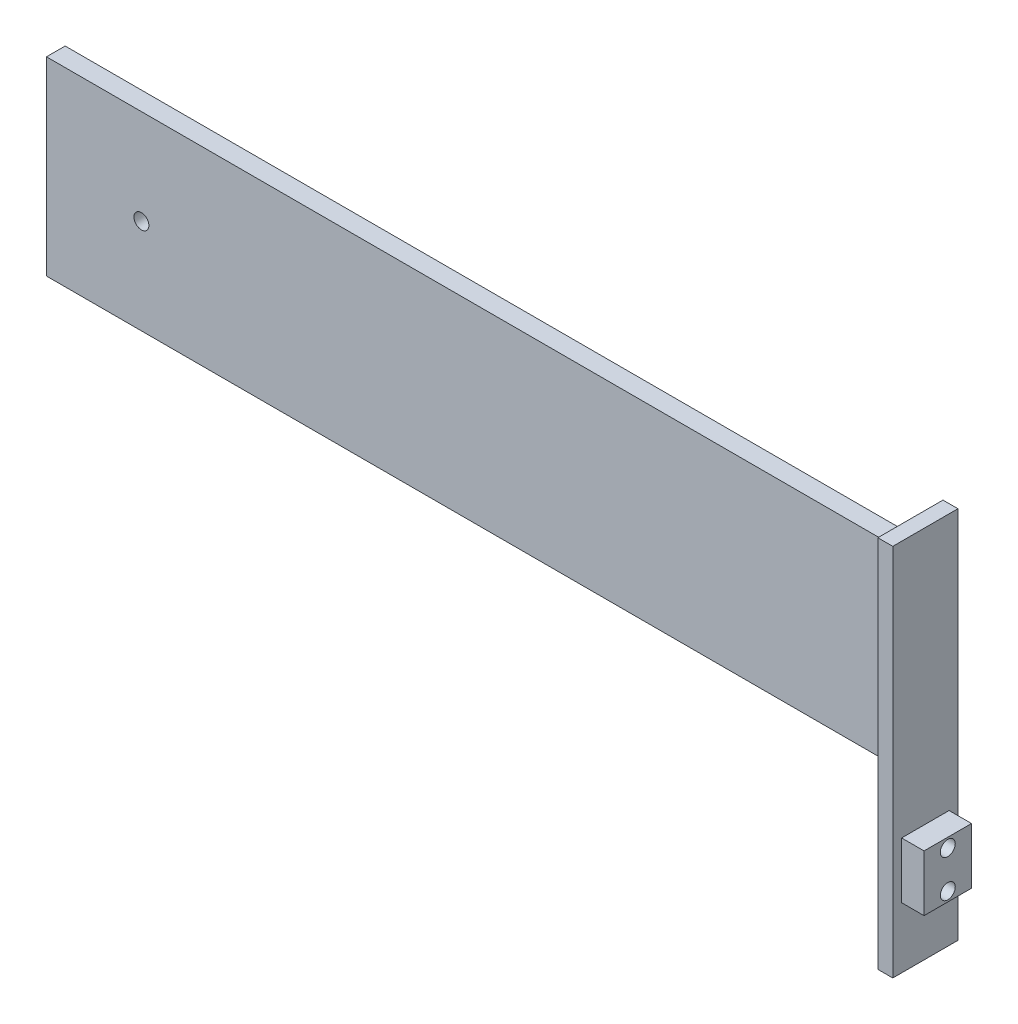
from build123d import *

# Parameters (mm, degrees)
SKETCH1_W           = 228.6
SKETCH1_H           = 50.8
BOSS_EXTRUDE1_DEPTH = 5
SKETCH2_R           = 2.000000064
CUT_EXTRUDE1_DEPTH  = 118.194923098
SKETCH3_W           = 17.431165178
SKETCH3_H           = 100
BOSS_EXTRUDE2_DEPTH = 4
SKETCH4_W           = 12.7
SKETCH4_H           = 15
BOSS_EXTRUDE3_DEPTH = 6
CUT_EXTRUDE2_REACH  = 250.519
SKETCH5_R           = 2.000000064
SKETCH5_R_2         = 2
SKETCH6_R           = 3.5
CUT_EXTRUDE3_DEPTH  = 3
FILLET2_R           = 2.54


with BuildPart() as part:
    # Sketch1 → Boss-Extrude1 (new body)
    with BuildSketch(Plane.XY):
        Rectangle(SKETCH1_W, SKETCH1_H)
    extrude(amount=BOSS_EXTRUDE1_DEPTH)

    # Sketch2 → Cut-Extrude1 (cut, through all)
    with BuildSketch(Plane.XY.offset(5)):
        with Locations((-88.9, 0)):
            Circle(SKETCH2_R)
    extrude(amount=-CUT_EXTRUDE1_DEPTH, mode=Mode.SUBTRACT)

    # Sketch3 → Boss-Extrude2 (add)
    with BuildSketch(Plane(origin=(114.3, 0, 0), x_dir=(0, 0, -1), z_dir=(1, 0, 0))):
        with Locations((-2.5, -18.6)):
            Rectangle(SKETCH3_W, SKETCH3_H)
    extrude(amount=BOSS_EXTRUDE2_DEPTH)

    # Sketch4 → Boss-Extrude3 (add)
    with BuildSketch(Plane(origin=(118.3, 0, 0), x_dir=(0, 0, -1), z_dir=(1, 0, 0))):
        with Locations((-2.5, -44.840000008)):
            Rectangle(SKETCH4_W, SKETCH4_H)
    extrude(amount=BOSS_EXTRUDE3_DEPTH)

    # Sketch5 → Cut-Extrude2 (cut, up to next)
    with BuildSketch(Plane(origin=(124.3, 0, 0), x_dir=(0, 0, -1), z_dir=(1, 0, 0)), mode=Mode.PRIVATE) as cut_extrude2_sk1:
        with Locations((-2.5, -39.840000088)):
            Circle(SKETCH5_R)
    cut_extrude2_tool1 = extrude(cut_extrude2_sk1.sketch, amount=-CUT_EXTRUDE2_REACH, mode=Mode.PRIVATE) & part.part
    # Sketch5 → Cut-Extrude2 (cut, up to next)
    with BuildSketch(Plane(origin=(124.3, 0, 0), x_dir=(0, 0, -1), z_dir=(1, 0, 0)), mode=Mode.PRIVATE) as cut_extrude2_sk2:
        with Locations((-2.5, -49.840000088)):
            Circle(SKETCH5_R_2)
    cut_extrude2_tool2 = extrude(cut_extrude2_sk2.sketch, amount=-CUT_EXTRUDE2_REACH, mode=Mode.PRIVATE) & part.part
    add(cut_extrude2_tool1.solids().sort_by_distance((124.3, -39.84, 2.5))[0], mode=Mode.SUBTRACT)
    add(cut_extrude2_tool2.solids().sort_by_distance((124.3, -49.84, 2.5))[0], mode=Mode.SUBTRACT)

    # Sketch6 → Cut-Extrude3 (cut)
    with BuildSketch(Plane.ZY.offset(-114.3)):
        with Locations((2.5, -39.840000088)):
            Circle(SKETCH6_R)
        with Locations((2.5, -49.840000088)):
            Circle(SKETCH6_R)
    extrude(amount=-CUT_EXTRUDE3_DEPTH, mode=Mode.SUBTRACT)

    # Fillet2
    fillet2_edges = [part.edges().sort_by_distance(p)[0] for p in [
        (114.3, 0, 5),
        (114.3, 0, 0),
        (114.3, -25.4, 2.5),
        (114.3, 25.4, 2.5),
    ]]
    fillet(fillet2_edges, radius=FILLET2_R)


solid = part.part
